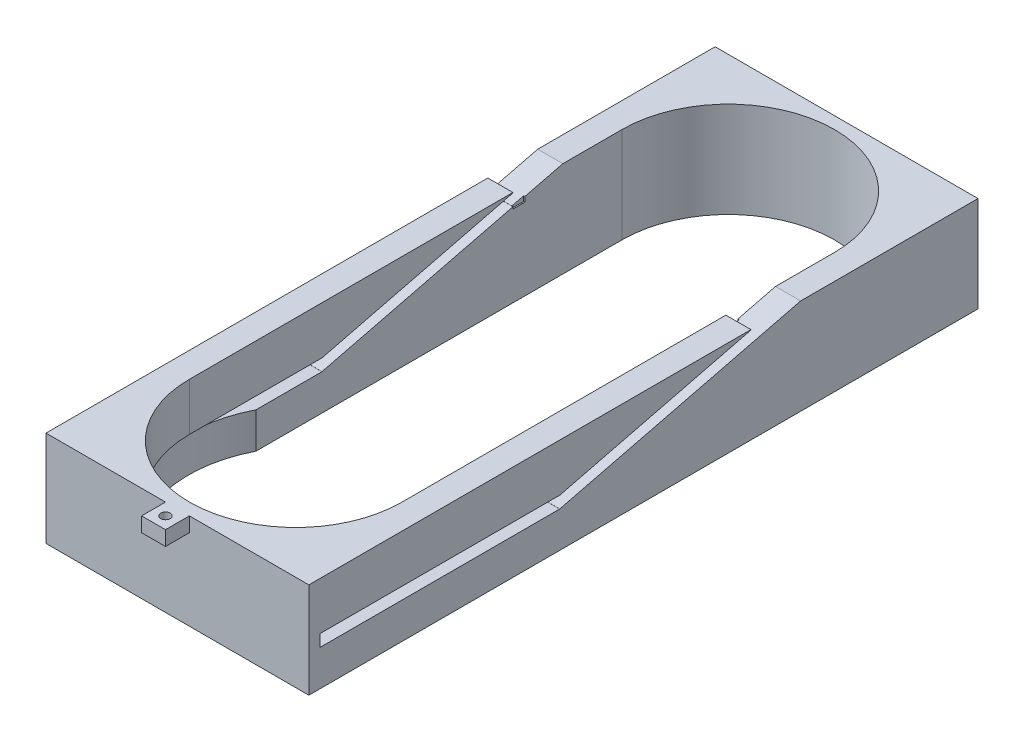
from build123d import *

# Parameters (mm, degrees)
SKETCH1_W           = 110
SKETCH1_H           = 280
BOSS_EXTRUDE1_DEPTH = 40
CUT_EXTRUDE2_DEPTH  = 124
SKETCH3_W           = 10.5
SKETCH3_H           = 5
CUT_EXTRUDE3_DEPTH  = 6
SKETCH4_W           = 10.5
SKETCH4_H           = 5
CUT_EXTRUDE4_DEPTH  = 6
CUT_EXTRUDE5_DEPTH  = 115
SKETCH6_W           = 5
SKETCH6_H           = 2.06188551
BOSS_EXTRUDE2_DEPTH = 10
SKETCH7_W           = 5
SKETCH7_H           = 2.339578052
BOSS_EXTRUDE3_DEPTH = 10
CUT_EXTRUDE6_DEPTH  = 128
SKETCH9_W           = 0.104698151
SKETCH9_H           = 1.212792293
CUT_EXTRUDE7_DEPTH  = 128
SKETCH10_W          = 100
SKETCH10_H          = 5
CUT_EXTRUDE9_DEPTH  = 128
SKETCH11_W          = 0.390083634
SKETCH11_H          = 4.996690545
CUT_EXTRUDE10_DEPTH = 128
SKETCH13_R          = 50
CUT_EXTRUDE11_DEPTH = 20
SKETCH14_W          = 10
SKETCH14_H          = 6.096695991
BOSS_EXTRUDE4_DEPTH = 10
SKETCH15_R          = 2
CUT_EXTRUDE12_DEPTH = 10


with BuildPart() as part:
    # Sketch1 → Boss-Extrude1 (new body)
    with BuildSketch(Plane(origin=(0, 0, 0), x_dir=(1, 0, 0), z_dir=(0, 1, 0))):
        with Locations((0, 71.043668932)):
            Rectangle(SKETCH1_W, SKETCH1_H)
        with BuildLine():
            Line((-44.5, -19.456331068), (-44.5, 161.543668932))
            ThreePointArc((-44.5, 161.543668932), (0, 206.043668932), (44.5, 161.543668932))
            Line((44.5, 161.543668932), (44.5, -19.456331068))
            ThreePointArc((44.5, -19.456331068), (0, -63.956331068), (-44.5, -19.456331068))
        make_face(mode=Mode.SUBTRACT)
    extrude(amount=BOSS_EXTRUDE1_DEPTH)

    # Sketch2 → Cut-Extrude2 (cut)
    with BuildSketch(Plane(origin=(55, 0, 0), x_dir=(0, 0, -1), z_dir=(1, 0, 0))):
        Polygon((116.043668932, 39.851089724), (36.043668932, 20), (35.922836705, 15.001460256), (116.043668932, 34.851089724), align=None)
    extrude(amount=-CUT_EXTRUDE2_DEPTH, mode=Mode.SUBTRACT)

    # Sketch3 → Cut-Extrude3 (cut)
    with BuildSketch(Plane(origin=(0, 40, 0), x_dir=(1, 0, 0), z_dir=(0, 1, 0))):
        with Locations((49.75, 118.535610254)):
            Rectangle(SKETCH3_W, SKETCH3_H)
    extrude(amount=-CUT_EXTRUDE3_DEPTH, mode=Mode.SUBTRACT)

    # Sketch4 → Cut-Extrude4 (cut)
    with BuildSketch(Plane(origin=(0, 40, 0), x_dir=(1, 0, 0), z_dir=(0, 1, 0))):
        with Locations((-49.75, 118.430912103)):
            Rectangle(SKETCH4_W, SKETCH4_H)
    extrude(amount=-CUT_EXTRUDE4_DEPTH, mode=Mode.SUBTRACT)

    # Sketch5 → Cut-Extrude5 (cut)
    with BuildSketch(Plane(origin=(55, 0, 0), x_dir=(0, 0, -1), z_dir=(1, 0, 0))):
        Polygon((116.035610254, 34.849093217), (136.82667534, 40), (116.035610254, 40), align=None)
    extrude(amount=-CUT_EXTRUDE5_DEPTH, mode=Mode.SUBTRACT)

    # Sketch6 → Boss-Extrude2 (add)
    with BuildSketch(Plane.ZY.offset(55)):
        with Locations((-118.430912103, 35.030942755)):
            Rectangle(SKETCH6_W, SKETCH6_H)
    extrude(amount=-BOSS_EXTRUDE2_DEPTH)

    # Sketch7 → Boss-Extrude3 (add)
    with BuildSketch(Plane(origin=(55, 0, 0), x_dir=(0, 0, -1), z_dir=(1, 0, 0))):
        with Locations((118.535610254, 35.169789026)):
            Rectangle(SKETCH7_W, SKETCH7_H)
    extrude(amount=-BOSS_EXTRUDE3_DEPTH)

    # Sketch8 → Cut-Extrude6 (cut)
    with BuildSketch(Plane(origin=(55, 0, 0), x_dir=(0, 0, -1), z_dir=(1, 0, 0))):
        Polygon((121.035610254, 36.087824076), (116.035610254, 34.849093217), (116.035610254, 36.339578052), (121.035610254, 36.339578052), align=None)
    extrude(amount=-CUT_EXTRUDE6_DEPTH, mode=Mode.SUBTRACT)

    # Sketch9 → Cut-Extrude7 (cut)
    with BuildSketch(Plane(origin=(-45, 0, 0), x_dir=(0, 0, -1), z_dir=(1, 0, 0))):
        with Locations((115.983261179, 35.455489364)):
            Rectangle(SKETCH9_W, SKETCH9_H)
    extrude(amount=-CUT_EXTRUDE7_DEPTH, mode=Mode.SUBTRACT)

    # Sketch10 → Cut-Extrude9 (cut)
    with BuildSketch(Plane(origin=(55, 0, 0), x_dir=(0, 0, -1), z_dir=(1, 0, 0))):
        with Locations((-14.346414702, 17.503309455)):
            Rectangle(SKETCH10_W, SKETCH10_H)
    extrude(amount=-CUT_EXTRUDE9_DEPTH, mode=Mode.SUBTRACT)

    # Sketch11 → Cut-Extrude10 (cut)
    with BuildSketch(Plane(origin=(55, 0, 0), x_dir=(0, 0, -1), z_dir=(1, 0, 0))):
        with Locations((35.848627115, 17.501654728)):
            Rectangle(SKETCH11_W, SKETCH11_H)
    extrude(amount=-CUT_EXTRUDE10_DEPTH, mode=Mode.SUBTRACT)

    # Sketch13 → Cut-Extrude11 (cut)
    with BuildSketch(Plane(origin=(0, 0, 0), x_dir=(-1, 0, 0), z_dir=(0, -1, 0))):
        with Locations((0, -14.346331068)):
            Circle(SKETCH13_R)
    extrude(amount=-CUT_EXTRUDE11_DEPTH, mode=Mode.SUBTRACT)

    # Sketch14 → Boss-Extrude4 (add)
    with BuildSketch(Plane.XY.offset(68.956331068)):
        with Locations((0, 36.951652005)):
            Rectangle(SKETCH14_W, SKETCH14_H)
    extrude(amount=BOSS_EXTRUDE4_DEPTH)

    # Sketch15 → Cut-Extrude12 (cut)
    with BuildSketch(Plane(origin=(0, 40, 0), x_dir=(1, 0, 0), z_dir=(0, 1, 0))):
        with Locations(Location((0, -73.956331068, 0), (0, 0, 270))):
            Circle(SKETCH15_R)
    extrude(amount=-CUT_EXTRUDE12_DEPTH, mode=Mode.SUBTRACT)


solid = part.part
